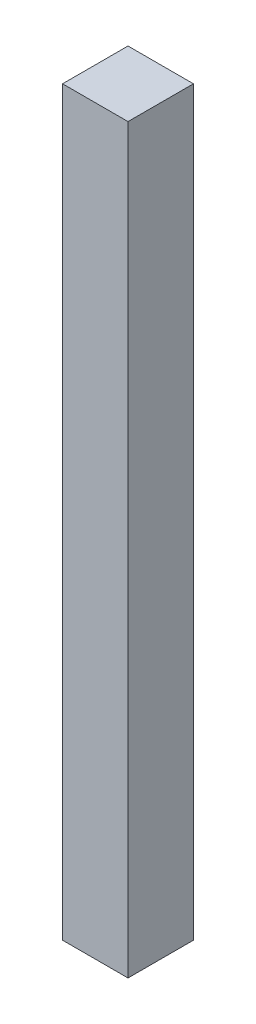
from build123d import *

# Parameters (mm, degrees)
SKETCH1_W           = 6
SKETCH1_H           = 6
BOSS_EXTRUDE1_DEPTH = 68


with BuildPart() as part:
    # Sketch1 → Boss-Extrude1 (new body)
    with BuildSketch(Plane(origin=(0, 0, 0), x_dir=(1, 0, 0), z_dir=(0, 1, 0))):
        Rectangle(SKETCH1_W, SKETCH1_H)
    extrude(amount=BOSS_EXTRUDE1_DEPTH)


solid = part.part
